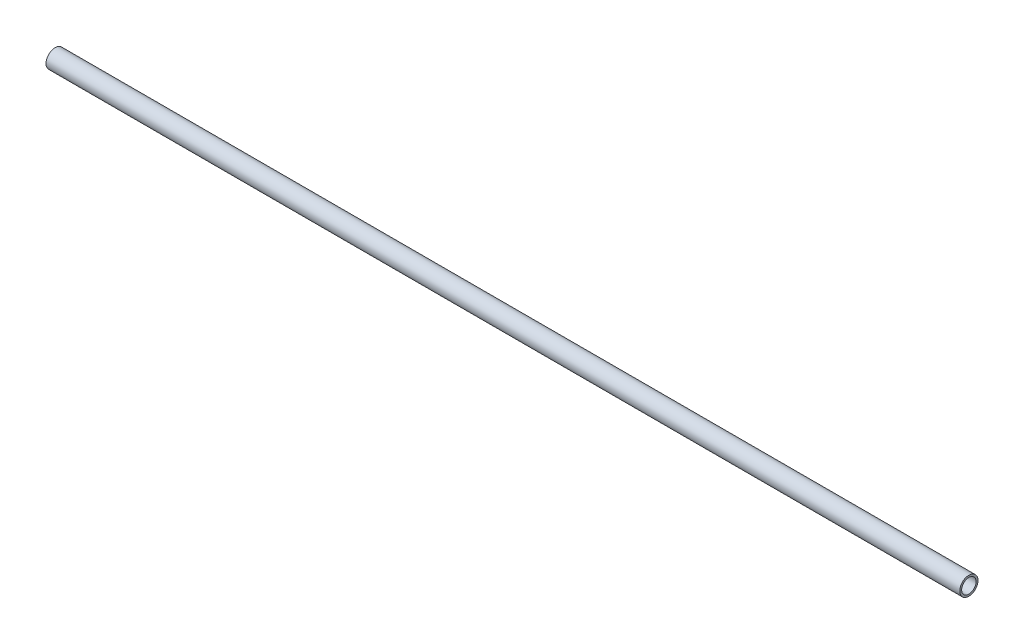
from build123d import *

# Parameters (mm, degrees)
CROQUIS1_R              = 19
CROQUIS1_R_2            = 15
SALIENTE_EXTRUIR1_DEPTH = 1900


with BuildPart() as part:
    # Croquis1 → Saliente-Extruir1 (new body)
    with BuildSketch(Plane(origin=(0, 0, 0), x_dir=(0, 0, -1), z_dir=(1, 0, 0))):
        with Locations(Location((0, 0, 0), (0, 0, 180))):
            Circle(CROQUIS1_R)
        with Locations(Location((0, 0, 0), (0, 0, 180))):
            Circle(CROQUIS1_R_2, mode=Mode.SUBTRACT)
    extrude(amount=SALIENTE_EXTRUIR1_DEPTH)


solid = part.part
